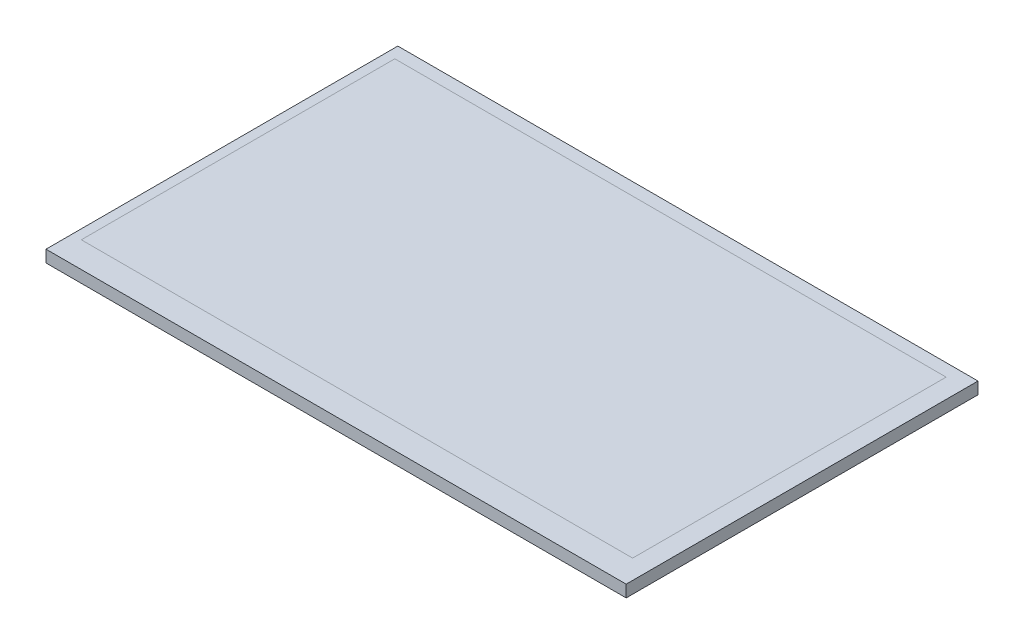
from build123d import *

# Parameters (mm, degrees)
SKETCH1_W           = 164.9
SKETCH1_H           = 100
BOSS_EXTRUDE1_DEPTH = 3.4


with BuildPart() as part:
    # Sketch1 → Boss-Extrude1 (new body)
    with BuildSketch(Plane(origin=(0, 0, 0), x_dir=(1, 0, 0), z_dir=(0, 1, 0))):
        Rectangle(SKETCH1_W, SKETCH1_H)
    extrude(amount=BOSS_EXTRUDE1_DEPTH)


solid = part.part
